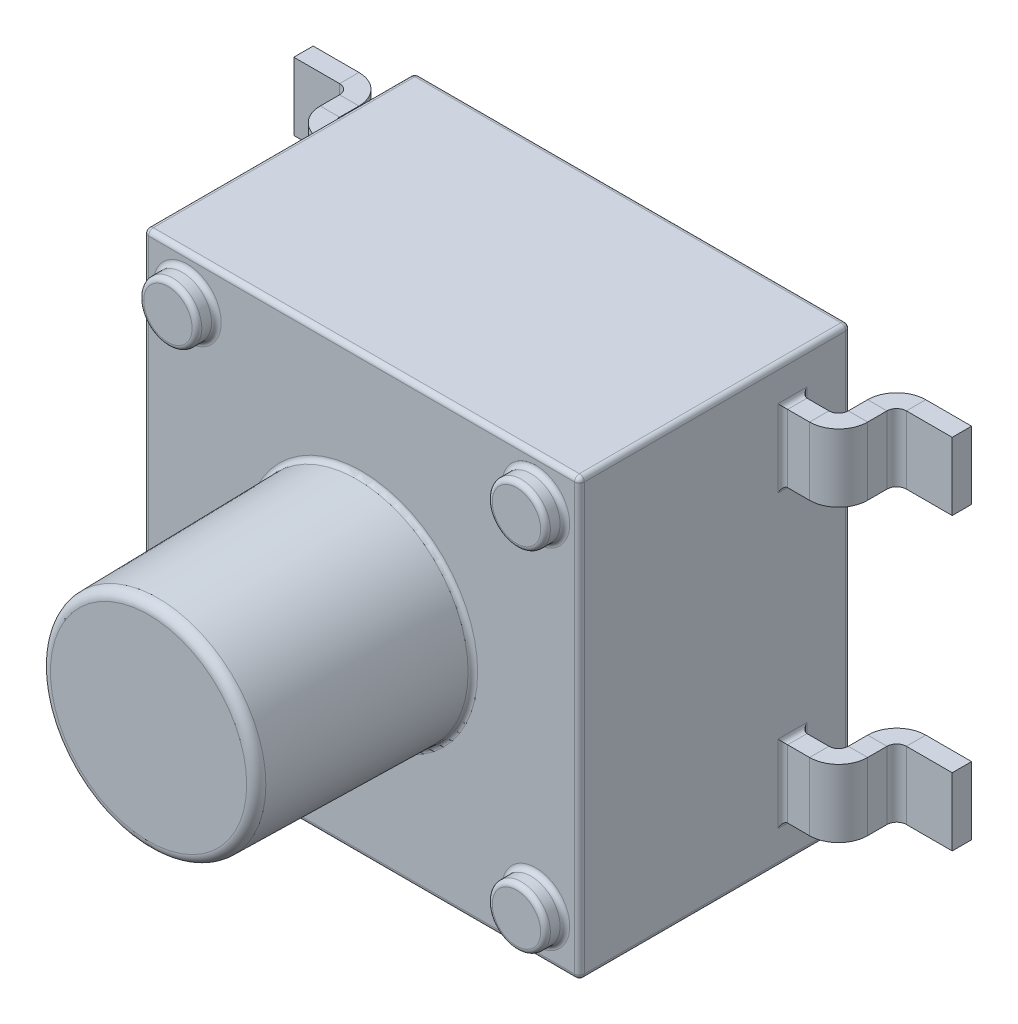
from build123d import *

# Parameters (mm, degrees)
SKETCH1_W               = 4.5
SKETCH1_H               = 4.5
BOSS_EXTRUDE1_DEPTH     = 2.5
SKETCH2_W               = 4.5
SKETCH2_H               = 4.5
BOSS_EXTRUDE2_DEPTH     = 0.3
SKETCH3_R               = 0.3
BOSS_EXTRUDE3_DEPTH     = 0.2
SKETCH4_R               = 1.15
BOSS_EXTRUDE4_DEPTH     = 2.2
BOSS_EXTRUDE4_TAPER     = 1
SKETCH6_W               = 0.2
SKETCH6_H               = 0.7
MIRROR2_COPY_1_SKETCH_W = 0.2
MIRROR2_COPY_1_SKETCH_H = 0.7
FILLET1_R               = 0.1
FILLET2_R               = 0.05
FILLET3_R               = 0.05


with BuildPart() as part:
    # Sketch1 → Boss-Extrude1 (new body)
    with BuildSketch(Plane.XY):
        Rectangle(SKETCH1_W, SKETCH1_H)
    extrude(amount=BOSS_EXTRUDE1_DEPTH)

    # Sketch2 → Boss-Extrude2 (add)
    with BuildSketch(Plane.XY.offset(2.5)):
        Rectangle(SKETCH2_W, SKETCH2_H)
    extrude(amount=BOSS_EXTRUDE2_DEPTH)

    # Sketch3 → Boss-Extrude3 (add)
    with BuildSketch(Plane.XY.offset(2.8)):
        with Locations((-1.8, 1.8)):
            Circle(SKETCH3_R)
        with Locations(Location((1.8, 1.8, 0), (0, 0, 180))):
            Circle(SKETCH3_R)
        with Locations((1.8, -1.8)):
            Circle(SKETCH3_R)
        with Locations(Location((-1.8, -1.8, 0), (0, 0, 180))):
            Circle(SKETCH3_R)
    extrude(amount=BOSS_EXTRUDE3_DEPTH)

    # Sketch4 → Boss-Extrude4 (add)
    with BuildSketch(Plane.XY.offset(2.8)):
        Circle(SKETCH4_R)
    extrude(amount=BOSS_EXTRUDE4_DEPTH, taper=BOSS_EXTRUDE4_TAPER)

    # Sweep4: sweep along a path in Sketch5
    with BuildLine(Plane(origin=(0, 0, 0), x_dir=(1, 0, 0), z_dir=(0, 1, 0))) as sweep4_path:
        Line((2.25, -0.6), (2.52672331, -0.6))
        ThreePointArc((2.52672331, -0.6), (2.668144666, -0.541421356), (2.72672331, -0.4))
        Line((2.72672331, -0.4), (2.72672331, -0.2))
        ThreePointArc((2.72672331, -0.2), (2.785301954, -0.058578644), (2.92672331, 0))
        Line((2.92672331, 0), (3.4, 0))
    # Sketch6 → Sweep4 (sweep)
    with BuildSketch(Plane(origin=(2.25, 0, 0), x_dir=(0, 0, -1), z_dir=(1, 0, 0))):
        with Locations((-0.6, 1.5)):
            Rectangle(SKETCH6_W, SKETCH6_H)
    sweep4 = sweep(path=sweep4_path.line)

    # Mirror1: Sweep4 across plane
    add(sweep4.mirror(Plane.ZX))

    # Mirror2: Sweep4 across plane
    add(sweep4.mirror(Plane(origin=(0, 0, 0), x_dir=(0, 0, 1), z_dir=(1, 0, 0))))

    # Mirror2 copy 1: sweep along a path in Mirror2 copy 1 path
    with BuildLine(Plane(origin=(0, 0, 0), x_dir=(-1, 0, 0), z_dir=(0, -1, 0))) as mirror2_copy_1_path:
        Line((2.25, -0.6), (2.52672331, -0.6))
        ThreePointArc((2.52672331, -0.6), (2.668144666, -0.541421356), (2.72672331, -0.4))
        Line((2.72672331, -0.4), (2.72672331, -0.2))
        ThreePointArc((2.72672331, -0.2), (2.785301954, -0.058578644), (2.92672331, 0))
        Line((2.92672331, 0), (3.4, 0))
    # Mirror2 copy 1 sketch → Mirror2 copy 1 (sweep)
    with BuildSketch(Plane(origin=(-2.25, 0, 0), x_dir=(0, 0, -1), z_dir=(-1, 0, 0))):
        with Locations((-0.6, 1.5)):
            Rectangle(MIRROR2_COPY_1_SKETCH_W, MIRROR2_COPY_1_SKETCH_H)
    sweep(path=mirror2_copy_1_path.line)

    # Fillet1
    fillet1_edges = [part.edges().sort_by_distance(p)[0] for p in [
        (-1.111598857, 0, 5),
    ]]
    fillet(fillet1_edges, radius=FILLET1_R)

    # Fillet2
    fillet2_edges = [part.edges().sort_by_distance(p)[0] for p in [
        (-2.1, 1.8, 3),
        (2.1, 1.8, 3),
        (1.5, -1.8, 3),
        (-1.5, -1.8, 3),
    ]]
    fillet(fillet2_edges, radius=FILLET2_R)

    # Fillet3
    fillet3_edges = [part.edges().sort_by_distance(p)[0] for p in [
        (-2.25, 1.5, 0.5),
        (-2.25, 1.15, 0.6),
        (-2.25, 1.5, 0.7),
        (-2.25, 1.85, 0.6),
        (-2.25, -1.5, 0.7),
        (-2.25, -1.15, 0.6),
        (-2.25, -1.5, 0.5),
        (-2.25, -1.85, 0.6),
        (2.25, 0, 2.8),
        (0, 2.25, 2.8),
        (-2.25, 0, 2.8),
        (0, -2.25, 2.8),
        (-2.1, 1.8, 2.8),
        (2.1, 1.8, 2.8),
        (1.5, -1.8, 2.8),
        (-1.5, -1.8, 2.8),
        (-1.15, 0, 2.8),
        (0, -2.25, 0),
        (2.25, 1.5, 0.7),
        (2.25, 1.15, 0.6),
        (2.25, 1.5, 0.5),
        (2.25, 1.85, 0.6),
        (-2.25, 0, 0),
        (0, 2.25, 0),
        (2.25, 0, 0),
        (2.25, -2.25, 1.4),
        (-2.25, -2.25, 1.4),
        (-2.25, 2.25, 1.4),
        (2.25, 2.25, 1.4),
        (2.25, -1.5, 0.5),
        (2.25, -1.15, 0.6),
        (2.25, -1.5, 0.7),
        (2.25, -1.85, 0.6),
    ]]
    fillet(fillet3_edges, radius=FILLET3_R)


solid = part.part
